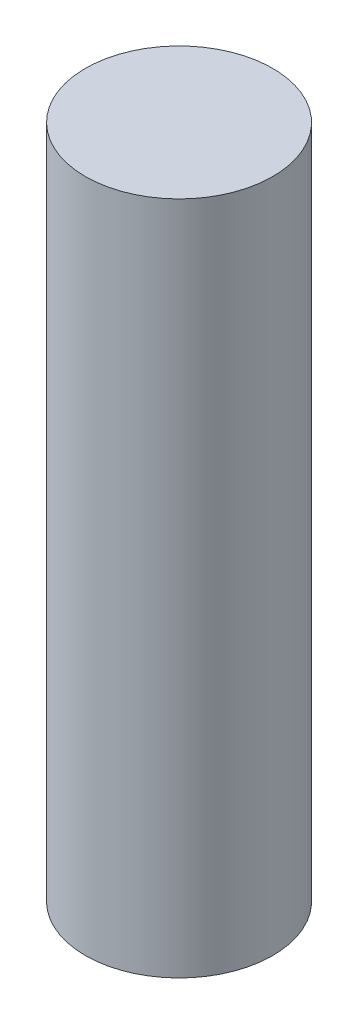
from build123d import *

# Parameters (mm, degrees)
SKETCH1_R           = 12.7
BOSS_EXTRUDE1_DEPTH = 66.04
SKETCH2_R           = 12.7
BOSS_EXTRUDE2_DEPTH = 25.4


with BuildPart() as part:
    # Sketch1 → Boss-Extrude1 (new body)
    with BuildSketch(Plane(origin=(0, 0, 0), x_dir=(1, 0, 0), z_dir=(0, 1, 0))):
        with Locations(Location((0, 0, 0), (0, 0, 270))):
            Circle(SKETCH1_R)
    extrude(amount=BOSS_EXTRUDE1_DEPTH)

    # Sketch2 → Boss-Extrude2 (add)
    with BuildSketch(Plane(origin=(0, 66.04, 0), x_dir=(1, 0, 0), z_dir=(0, 1, 0))):
        with Locations(Location((0, 0, 0), (0, 0, 270))):
            Circle(SKETCH2_R)
    extrude(amount=BOSS_EXTRUDE2_DEPTH)


solid = part.part
